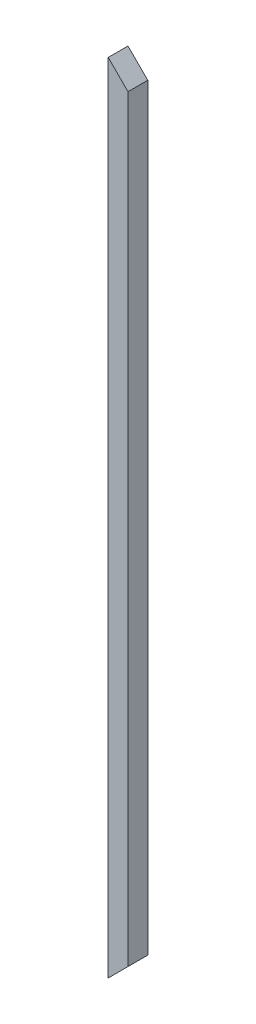
from build123d import *

# Parameters (mm, degrees)
SKETCH_1_W          = 50
SKETCH_1_H          = 50
EXTRUDE_1_DEPTH     = 2015.25
CUT_EXTRUDE_1_DEPTH = 3000


with BuildPart() as part:
    # Эскиз1 → Бобышка-Вытянуть1 (new body)
    with BuildSketch(Plane(origin=(0, 0, 0), x_dir=(1, 0, 0), z_dir=(0, 1, 0))):
        Rectangle(SKETCH_1_W, SKETCH_1_H)
    extrude(amount=EXTRUDE_1_DEPTH)

    # Эскиз7 → Вырез-Вытянуть1 (cut)
    with BuildSketch(Plane(origin=(0, 0, -25), x_dir=(-1, 0, 0), z_dir=(0, 0, -1))):
        Polygon((-25, 0), (25, 0), (-25, 50), align=None)
        Polygon((-25, 2015.25), (25, 2015.25), (-25, 1965.25), align=None)
    extrude(amount=-CUT_EXTRUDE_1_DEPTH, mode=Mode.SUBTRACT)


solid = part.part
